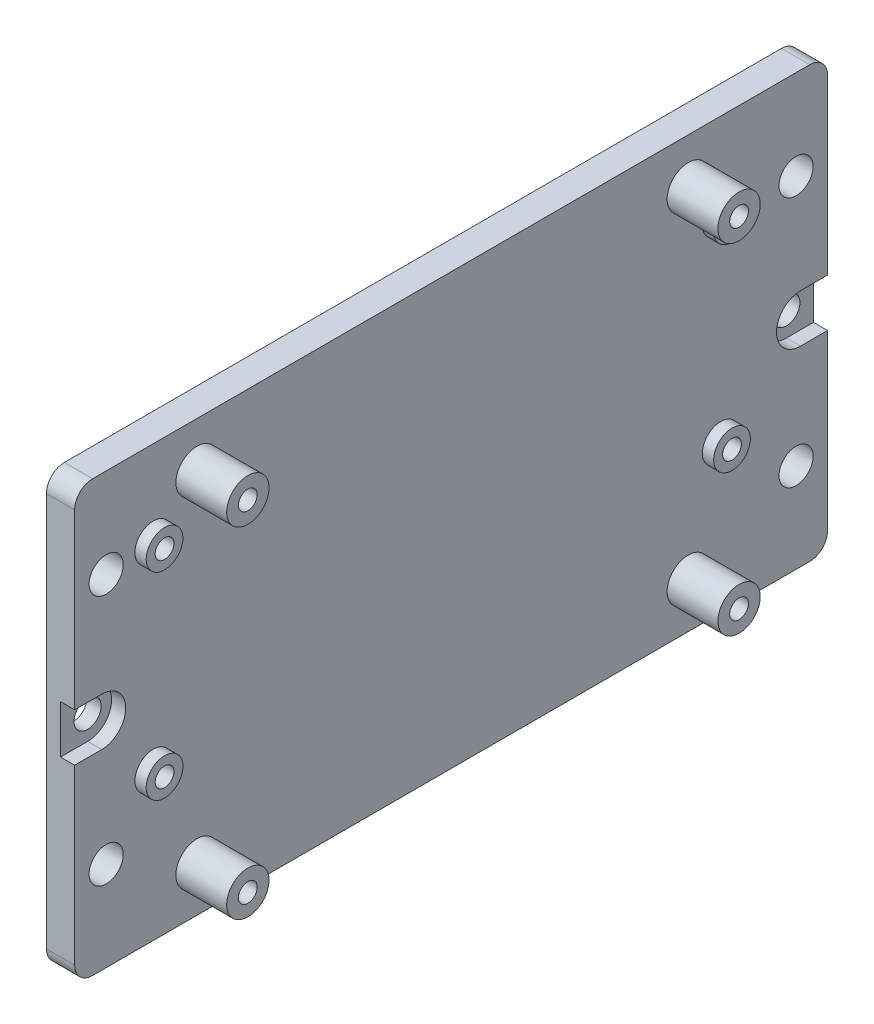
from build123d import *

# Parameters (mm, degrees)
SKETCH1_W            = 133.35
SKETCH1_H            = 76.2
BOSS_EXTRUDE1_DEPTH  = 5
FILLET1_R            = 3.175
SKETCH2_R            = 3.025
CUT_EXTRUDE1_DEPTH   = 77.955608145
SKETCH5_R            = 3.25
SKETCH5_R_2          = 1.665
BOSS_EXTRUDE2_DEPTH  = 2
CUT_EXTRUDE2_START   = -6
SKETCH6_R            = 1.665
CUT_EXTRUDE2_DEPTH   = 6
SKETCH8_R            = 3.75
BOSS_EXTRUDE4_DEPTH  = 9
SKETCH9_R            = 1.665
CUT_EXTRUDE3_DEPTH   = 5
M4_CLEARANCE_HOLE1_D = 4.8
SKETCH16_R           = 4.25
SKETCH16_R_2         = 2.4
CUT_EXTRUDE4_DEPTH   = 2.5


with BuildPart() as part:
    # Sketch1 → Boss-Extrude1 (new body)
    with BuildSketch(Plane(origin=(0, 0, 0), x_dir=(0, 0, -1), z_dir=(1, 0, 0))):
        Rectangle(SKETCH1_W, SKETCH1_H)
    extrude(amount=BOSS_EXTRUDE1_DEPTH)

    # Fillet1
    fillet1_edges = [part.edges().sort_by_distance(p)[0] for p in [
        (2.5, -38.1, -66.675),
        (2.5, -38.1, 66.675),
        (2.5, 38.1, 66.675),
        (2.5, 38.1, -66.675),
    ]]
    fillet(fillet1_edges, radius=FILLET1_R)

    # Sketch2 → Cut-Extrude1 (cut, through all)
    with BuildSketch(Plane.ZY):
        with Locations((-61.09, -22.225)):
            Circle(SKETCH2_R)
        with Locations((-61.09, 22.225)):
            Circle(SKETCH2_R)
        with Locations((61.09, -22.225)):
            Circle(SKETCH2_R)
        with Locations((61.09, 22.225)):
            Circle(SKETCH2_R)
    extrude(amount=-CUT_EXTRUDE1_DEPTH, mode=Mode.SUBTRACT)

    # Sketch5 → Boss-Extrude2 (add)
    # profile 1 of 4: a face of its own
    with BuildSketch(Plane(origin=(5, 0, 0), x_dir=(0, 0, -1), z_dir=(1, 0, 0))):
        with Locations((-52.75, 23)):
            Circle(SKETCH5_R)
        with Locations((-52.75, 23)):
            Circle(SKETCH5_R_2, mode=Mode.SUBTRACT)
    # profile 2 of 4: a face of its own
    with BuildSketch(Plane(origin=(5, 0, 0), x_dir=(0, 0, -1), z_dir=(1, 0, 0))):
        with Locations((-52.75, -12)):
            Circle(SKETCH5_R)
        with Locations((-52.75, -12)):
            Circle(SKETCH5_R_2, mode=Mode.SUBTRACT)
    # profile 3 of 4: a face of its own
    with BuildSketch(Plane(origin=(5, 0, 0), x_dir=(0, 0, -1), z_dir=(1, 0, 0))):
        with Locations((47.75, 23)):
            Circle(SKETCH5_R)
        with Locations((47.75, 23)):
            Circle(SKETCH5_R_2, mode=Mode.SUBTRACT)
    # profile 4 of 4: a face of its own
    with BuildSketch(Plane(origin=(5, 0, 0), x_dir=(0, 0, -1), z_dir=(1, 0, 0))):
        with Locations((47.75, -12)):
            Circle(SKETCH5_R)
    extrude(amount=BOSS_EXTRUDE2_DEPTH)

    # Sketch6 → Cut-Extrude2 (cut)
    with BuildSketch(Plane(origin=(7, 0, 0), x_dir=(0, 0, -1), z_dir=(1, 0, 0)).offset(CUT_EXTRUDE2_START)):
        with Locations((-52.75, -12)):
            Circle(SKETCH6_R)
        with Locations((-52.75, 23)):
            Circle(SKETCH6_R)
        with Locations((47.75, -12)):
            Circle(SKETCH6_R)
        with Locations((47.75, 23)):
            Circle(SKETCH6_R)
    extrude(amount=CUT_EXTRUDE2_DEPTH, mode=Mode.SUBTRACT)

    # Sketch8 → Boss-Extrude4 (add)
    with BuildSketch(Plane(origin=(5, 0, 0), x_dir=(0, 0, -1), z_dir=(1, 0, 0))):
        with Locations((-45, -30.1)):
            Circle(SKETCH8_R)
        with Locations((-45, 30.1)):
            Circle(SKETCH8_R)
        with Locations((42, 30.1)):
            Circle(SKETCH8_R)
        with Locations((42, -30.1)):
            Circle(SKETCH8_R)
    extrude(amount=BOSS_EXTRUDE4_DEPTH)

    # Sketch9 → Cut-Extrude3 (cut)
    with BuildSketch(Plane(origin=(14, 0, 0), x_dir=(0, 0, -1), z_dir=(1, 0, 0))):
        with Locations((-45, -30.1)):
            Circle(SKETCH9_R)
        with Locations((-45, 30.1)):
            Circle(SKETCH9_R)
        with Locations((42, 30.1)):
            Circle(SKETCH9_R)
        with Locations((42, -30.1)):
            Circle(SKETCH9_R)
    extrude(amount=-CUT_EXTRUDE3_DEPTH, mode=Mode.SUBTRACT)

    # M4 Clearance Hole1 (through all)
    with Locations(Plane(origin=(-0.0007, 0, 61.8815), x_dir=(0, 0, -1), z_dir=(-1, 0, 0))):
        with Locations((0, 0), (123.763, 0)):
            Hole(M4_CLEARANCE_HOLE1_D / 2)

    # Sketch16 → Cut-Extrude4 (cut)
    # profile 1 of 6: a face of its own
    with BuildSketch(Plane(origin=(5, 0, 0), x_dir=(0, 0, -1), z_dir=(1, 0, 0))):
        with Locations((-61.8815, 0)):
            Circle(SKETCH16_R)
        with Locations((-61.8815, 0)):
            Circle(SKETCH16_R_2, mode=Mode.SUBTRACT)
    # profile 2 of 6: a face of its own
    with BuildSketch(Plane(origin=(5, 0, 0), x_dir=(0, 0, -1), z_dir=(1, 0, 0))):
        with BuildLine():
            ThreePointArc((-61.8815, -4.25), (-66.1315, 0), (-61.8815, 4.25))
            Line((-61.8815, 4.25), (-66.675, 4.25))
            Line((-66.675, 4.25), (-66.675, -4.25))
            Line((-66.675, -4.25), (-61.8815, -4.25))
        make_face()
    # profile 3 of 6: a face of its own
    with BuildSketch(Plane(origin=(5, 0, 0), x_dir=(0, 0, -1), z_dir=(1, 0, 0))):
        with Locations((-61.8815, 0)):
            Circle(SKETCH16_R_2)
    # profile 4 of 6: a face of its own
    with BuildSketch(Plane(origin=(5, 0, 0), x_dir=(0, 0, -1), z_dir=(1, 0, 0))):
        with Locations((61.8815, 0)):
            Circle(SKETCH16_R)
        with Locations((61.8815, 0)):
            Circle(SKETCH16_R_2, mode=Mode.SUBTRACT)
    # profile 5 of 6: a face of its own
    with BuildSketch(Plane(origin=(5, 0, 0), x_dir=(0, 0, -1), z_dir=(1, 0, 0))):
        with BuildLine():
            Line((66.675, 4.25), (61.8815, 4.25))
            ThreePointArc((61.8815, 4.25), (64.88670382, 3.00520382), (66.1315, 0))
            ThreePointArc((66.1315, 0), (64.88670382, -3.00520382), (61.8815, -4.25))
            Line((61.8815, -4.25), (66.675, -4.25))
            Line((66.675, -4.25), (66.675, 4.25))
        make_face()
    # profile 6 of 6: a face of its own
    with BuildSketch(Plane(origin=(5, 0, 0), x_dir=(0, 0, -1), z_dir=(1, 0, 0))):
        with Locations((61.8815, 0)):
            Circle(SKETCH16_R_2)
    extrude(amount=-CUT_EXTRUDE4_DEPTH, mode=Mode.SUBTRACT)


solid = part.part
